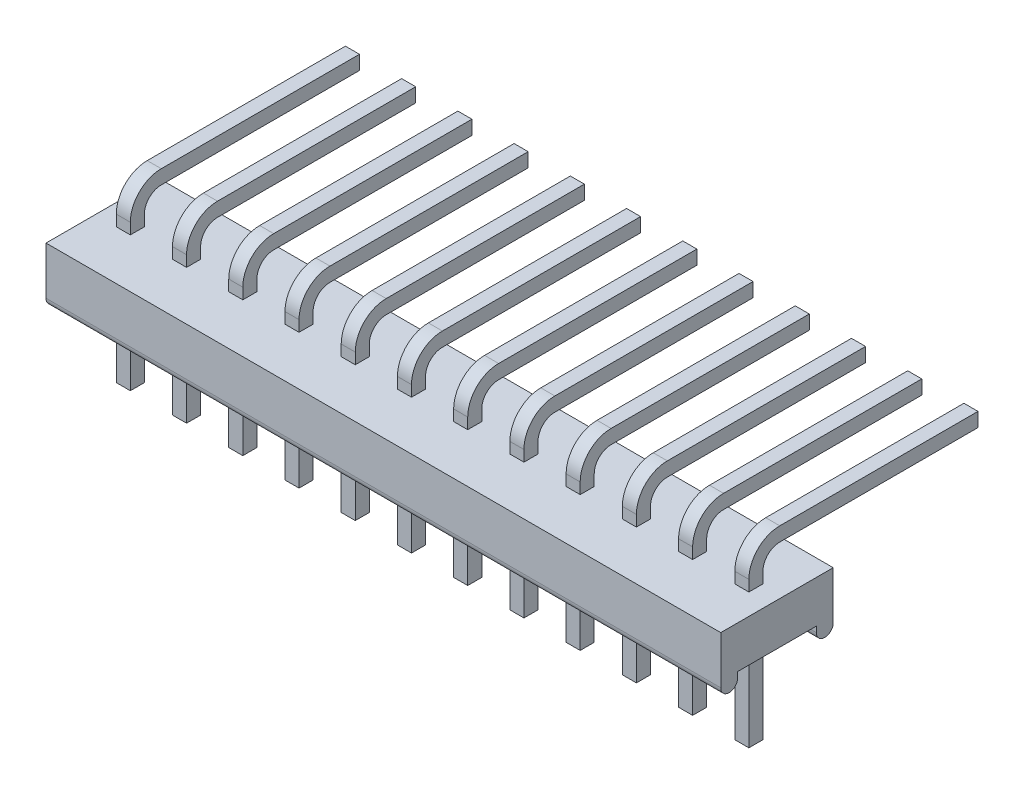
from build123d import *

# Parameters (mm, degrees)
SALIENTE_EXTRUIR1_DEPTH  = 30.48
CROQUIS2_W               = 0.635
CROQUIS2_H               = 0.635
SALIENTE_EXTRUIR2_DEPTH  = 1.8923
CROQUIS3_W               = 0.635
CROQUIS3_H               = 0.635
SALIENTE_EXTRUIR3_DEPTH  = 9.7155
CROQUIS4_W               = 0.635
CROQUIS4_H               = 0.635
SALIENTE_EXTRUIR4_DEPTH  = 1.8923
CROQUIS5_W               = 0.635
CROQUIS5_H               = 0.635
SALIENTE_EXTRUIR5_DEPTH  = 9.7155
CROQUIS6_W               = 0.635
CROQUIS6_H               = 0.635
SALIENTE_EXTRUIR6_DEPTH  = 1.8923
CROQUIS7_W               = 0.635
CROQUIS7_H               = 0.635
SALIENTE_EXTRUIR7_DEPTH  = 9.7155
CROQUIS8_W               = 0.635
CROQUIS8_H               = 0.635
SALIENTE_EXTRUIR8_DEPTH  = 1.8923
CROQUIS9_W               = 0.635
CROQUIS9_H               = 0.635
SALIENTE_EXTRUIR9_DEPTH  = 9.7155
CROQUIS10_W              = 0.635
CROQUIS10_H              = 0.635
SALIENTE_EXTRUIR10_DEPTH = 1.8923
CROQUIS11_W              = 0.635
CROQUIS11_H              = 0.635
SALIENTE_EXTRUIR11_DEPTH = 9.7155
CROQUIS12_W              = 0.635
CROQUIS12_H              = 0.635
SALIENTE_EXTRUIR12_DEPTH = 1.8923
CROQUIS13_W              = 0.635
CROQUIS13_H              = 0.635
SALIENTE_EXTRUIR13_DEPTH = 9.7155
CROQUIS14_W              = 0.635
CROQUIS14_H              = 0.635
SALIENTE_EXTRUIR14_DEPTH = 1.8923
CROQUIS15_W              = 0.635
CROQUIS15_H              = 0.635
SALIENTE_EXTRUIR15_DEPTH = 9.7155
CROQUIS16_W              = 0.635
CROQUIS16_H              = 0.635
SALIENTE_EXTRUIR16_DEPTH = 1.8923
CROQUIS17_W              = 0.635
CROQUIS17_H              = 0.635
SALIENTE_EXTRUIR17_DEPTH = 9.7155
CROQUIS18_W              = 0.635
CROQUIS18_H              = 0.635
SALIENTE_EXTRUIR18_DEPTH = 1.8923
CROQUIS19_W              = 0.635
CROQUIS19_H              = 0.635
SALIENTE_EXTRUIR19_DEPTH = 9.7155
CROQUIS20_W              = 0.635
CROQUIS20_H              = 0.635
SALIENTE_EXTRUIR20_DEPTH = 1.8923
CROQUIS21_W              = 0.635
CROQUIS21_H              = 0.635
SALIENTE_EXTRUIR21_DEPTH = 9.7155
CROQUIS22_W              = 0.635
CROQUIS22_H              = 0.635
SALIENTE_EXTRUIR22_DEPTH = 1.8923
CROQUIS23_W              = 0.635
CROQUIS23_H              = 0.635
SALIENTE_EXTRUIR23_DEPTH = 9.7155
CROQUIS24_W              = 0.635
CROQUIS24_H              = 0.635
SALIENTE_EXTRUIR24_DEPTH = 1.8923
CROQUIS25_W              = 0.635
CROQUIS25_H              = 0.635
SALIENTE_EXTRUIR25_DEPTH = 9.7155
CROQUIS26_W              = 0.635
CROQUIS26_H              = 0.635
SALIENTE_EXTRUIR26_DEPTH = 4.191
CROQUIS27_W              = 0.635
CROQUIS27_H              = 0.635
SALIENTE_EXTRUIR27_DEPTH = 4.191
CROQUIS28_W              = 0.635
CROQUIS28_H              = 0.635
SALIENTE_EXTRUIR28_DEPTH = 4.191
CROQUIS29_W              = 0.635
CROQUIS29_H              = 0.635
SALIENTE_EXTRUIR29_DEPTH = 4.191
CROQUIS30_W              = 0.635
CROQUIS30_H              = 0.635
SALIENTE_EXTRUIR30_DEPTH = 4.191
CROQUIS31_W              = 0.635
CROQUIS31_H              = 0.635
SALIENTE_EXTRUIR31_DEPTH = 4.191
CROQUIS32_W              = 0.635
CROQUIS32_H              = 0.635
SALIENTE_EXTRUIR32_DEPTH = 4.191
CROQUIS33_W              = 0.635
CROQUIS33_H              = 0.635
SALIENTE_EXTRUIR33_DEPTH = 4.191
CROQUIS34_W              = 0.635
CROQUIS34_H              = 0.635
SALIENTE_EXTRUIR34_DEPTH = 4.191
CROQUIS35_W              = 0.635
CROQUIS35_H              = 0.635
SALIENTE_EXTRUIR35_DEPTH = 4.191
CROQUIS36_W              = 0.635
CROQUIS36_H              = 0.635
SALIENTE_EXTRUIR36_DEPTH = 4.191
CROQUIS37_W              = 0.635
CROQUIS37_H              = 0.635
SALIENTE_EXTRUIR37_DEPTH = 4.191
REDONDEO1_R              = 0.762
REDONDEO2_R              = 1.397


with BuildPart() as part:
    # Croquis1 → Saliente-Extruir1 (new body)
    with BuildSketch(Plane(origin=(15.24, 0, 0), x_dir=(0, 0, -1), z_dir=(1, 0, 0))):
        with BuildLine():
            Line((-2.54, 1.905), (-2.54, -0.254))
            ThreePointArc((-2.54, -0.254), (-2.159, -0.635), (-1.778, -0.254))
            Line((-1.778, -0.254), (-1.778, 0))
            Line((-1.778, 0), (1.778, 0))
            Line((1.778, 0), (1.778, -0.254))
            ThreePointArc((1.778, -0.254), (2.159, -0.635), (2.54, -0.254))
            Line((2.54, -0.254), (2.54, 1.905))
            Line((2.54, 1.905), (-2.54, 1.905))
        make_face()
    extrude(amount=-SALIENTE_EXTRUIR1_DEPTH)

    # Croquis2 → Saliente-Extruir2 (add)
    with BuildSketch(Plane(origin=(0, 1.905, 0), x_dir=(-1, 0, 0), z_dir=(0, 1, 0))):
        with Locations((-13.97, 0)):
            Rectangle(CROQUIS2_W, CROQUIS2_H)
    extrude(amount=SALIENTE_EXTRUIR2_DEPTH)

    # Croquis3 → Saliente-Extruir3 (add)
    with BuildSketch(Plane(origin=(0, 0, -0.3175), x_dir=(-1, 0, 0), z_dir=(0, 0, -1))):
        with Locations((-13.97, 3.4798)):
            Rectangle(CROQUIS3_W, CROQUIS3_H)
    extrude(amount=SALIENTE_EXTRUIR3_DEPTH)

    # Croquis4 → Saliente-Extruir4 (add)
    with BuildSketch(Plane(origin=(0, 1.905, 0), x_dir=(-1, 0, 0), z_dir=(0, 1, 0))):
        with Locations((-11.43, 0)):
            Rectangle(CROQUIS4_W, CROQUIS4_H)
    extrude(amount=SALIENTE_EXTRUIR4_DEPTH)

    # Croquis5 → Saliente-Extruir5 (add)
    with BuildSketch(Plane(origin=(0, 0, -0.3175), x_dir=(-1, 0, 0), z_dir=(0, 0, -1))):
        with Locations((-11.43, 3.4798)):
            Rectangle(CROQUIS5_W, CROQUIS5_H)
    extrude(amount=SALIENTE_EXTRUIR5_DEPTH)

    # Croquis6 → Saliente-Extruir6 (add)
    with BuildSketch(Plane(origin=(0, 1.905, 0), x_dir=(-1, 0, 0), z_dir=(0, 1, 0))):
        with Locations((-8.89, 0)):
            Rectangle(CROQUIS6_W, CROQUIS6_H)
    extrude(amount=SALIENTE_EXTRUIR6_DEPTH)

    # Croquis7 → Saliente-Extruir7 (add)
    with BuildSketch(Plane(origin=(0, 0, -0.3175), x_dir=(-1, 0, 0), z_dir=(0, 0, -1))):
        with Locations((-8.89, 3.4798)):
            Rectangle(CROQUIS7_W, CROQUIS7_H)
    extrude(amount=SALIENTE_EXTRUIR7_DEPTH)

    # Croquis8 → Saliente-Extruir8 (add)
    with BuildSketch(Plane(origin=(0, 1.905, 0), x_dir=(-1, 0, 0), z_dir=(0, 1, 0))):
        with Locations((-6.35, 0)):
            Rectangle(CROQUIS8_W, CROQUIS8_H)
    extrude(amount=SALIENTE_EXTRUIR8_DEPTH)

    # Croquis9 → Saliente-Extruir9 (add)
    with BuildSketch(Plane(origin=(0, 0, -0.3175), x_dir=(-1, 0, 0), z_dir=(0, 0, -1))):
        with Locations((-6.35, 3.4798)):
            Rectangle(CROQUIS9_W, CROQUIS9_H)
    extrude(amount=SALIENTE_EXTRUIR9_DEPTH)

    # Croquis10 → Saliente-Extruir10 (add)
    with BuildSketch(Plane(origin=(0, 1.905, 0), x_dir=(-1, 0, 0), z_dir=(0, 1, 0))):
        with Locations((-3.81, 0)):
            Rectangle(CROQUIS10_W, CROQUIS10_H)
    extrude(amount=SALIENTE_EXTRUIR10_DEPTH)

    # Croquis11 → Saliente-Extruir11 (add)
    with BuildSketch(Plane(origin=(0, 0, -0.3175), x_dir=(-1, 0, 0), z_dir=(0, 0, -1))):
        with Locations((-3.81, 3.4798)):
            Rectangle(CROQUIS11_W, CROQUIS11_H)
    extrude(amount=SALIENTE_EXTRUIR11_DEPTH)

    # Croquis12 → Saliente-Extruir12 (add)
    with BuildSketch(Plane(origin=(0, 1.905, 0), x_dir=(-1, 0, 0), z_dir=(0, 1, 0))):
        with Locations((-1.27, 0)):
            Rectangle(CROQUIS12_W, CROQUIS12_H)
    extrude(amount=SALIENTE_EXTRUIR12_DEPTH)

    # Croquis13 → Saliente-Extruir13 (add)
    with BuildSketch(Plane(origin=(0, 0, -0.3175), x_dir=(-1, 0, 0), z_dir=(0, 0, -1))):
        with Locations((-1.27, 3.4798)):
            Rectangle(CROQUIS13_W, CROQUIS13_H)
    extrude(amount=SALIENTE_EXTRUIR13_DEPTH)

    # Croquis14 → Saliente-Extruir14 (add)
    with BuildSketch(Plane(origin=(0, 1.905, 0), x_dir=(-1, 0, 0), z_dir=(0, 1, 0))):
        with Locations((1.27, 0)):
            Rectangle(CROQUIS14_W, CROQUIS14_H)
    extrude(amount=SALIENTE_EXTRUIR14_DEPTH)

    # Croquis15 → Saliente-Extruir15 (add)
    with BuildSketch(Plane(origin=(0, 0, -0.3175), x_dir=(-1, 0, 0), z_dir=(0, 0, -1))):
        with Locations((1.27, 3.4798)):
            Rectangle(CROQUIS15_W, CROQUIS15_H)
    extrude(amount=SALIENTE_EXTRUIR15_DEPTH)

    # Croquis16 → Saliente-Extruir16 (add)
    with BuildSketch(Plane(origin=(0, 1.905, 0), x_dir=(-1, 0, 0), z_dir=(0, 1, 0))):
        with Locations((3.81, 0)):
            Rectangle(CROQUIS16_W, CROQUIS16_H)
    extrude(amount=SALIENTE_EXTRUIR16_DEPTH)

    # Croquis17 → Saliente-Extruir17 (add)
    with BuildSketch(Plane(origin=(0, 0, -0.3175), x_dir=(-1, 0, 0), z_dir=(0, 0, -1))):
        with Locations((3.81, 3.4798)):
            Rectangle(CROQUIS17_W, CROQUIS17_H)
    extrude(amount=SALIENTE_EXTRUIR17_DEPTH)

    # Croquis18 → Saliente-Extruir18 (add)
    with BuildSketch(Plane(origin=(0, 1.905, 0), x_dir=(-1, 0, 0), z_dir=(0, 1, 0))):
        with Locations((6.35, 0)):
            Rectangle(CROQUIS18_W, CROQUIS18_H)
    extrude(amount=SALIENTE_EXTRUIR18_DEPTH)

    # Croquis19 → Saliente-Extruir19 (add)
    with BuildSketch(Plane(origin=(0, 0, -0.3175), x_dir=(-1, 0, 0), z_dir=(0, 0, -1))):
        with Locations((6.35, 3.4798)):
            Rectangle(CROQUIS19_W, CROQUIS19_H)
    extrude(amount=SALIENTE_EXTRUIR19_DEPTH)

    # Croquis20 → Saliente-Extruir20 (add)
    with BuildSketch(Plane(origin=(0, 1.905, 0), x_dir=(-1, 0, 0), z_dir=(0, 1, 0))):
        with Locations((8.89, 0)):
            Rectangle(CROQUIS20_W, CROQUIS20_H)
    extrude(amount=SALIENTE_EXTRUIR20_DEPTH)

    # Croquis21 → Saliente-Extruir21 (add)
    with BuildSketch(Plane(origin=(0, 0, -0.3175), x_dir=(-1, 0, 0), z_dir=(0, 0, -1))):
        with Locations((8.89, 3.4798)):
            Rectangle(CROQUIS21_W, CROQUIS21_H)
    extrude(amount=SALIENTE_EXTRUIR21_DEPTH)

    # Croquis22 → Saliente-Extruir22 (add)
    with BuildSketch(Plane(origin=(0, 1.905, 0), x_dir=(-1, 0, 0), z_dir=(0, 1, 0))):
        with Locations((11.43, 0)):
            Rectangle(CROQUIS22_W, CROQUIS22_H)
    extrude(amount=SALIENTE_EXTRUIR22_DEPTH)

    # Croquis23 → Saliente-Extruir23 (add)
    with BuildSketch(Plane(origin=(0, 0, -0.3175), x_dir=(-1, 0, 0), z_dir=(0, 0, -1))):
        with Locations((11.43, 3.4798)):
            Rectangle(CROQUIS23_W, CROQUIS23_H)
    extrude(amount=SALIENTE_EXTRUIR23_DEPTH)

    # Croquis24 → Saliente-Extruir24 (add)
    with BuildSketch(Plane(origin=(0, 1.905, 0), x_dir=(-1, 0, 0), z_dir=(0, 1, 0))):
        with Locations((13.97, 0)):
            Rectangle(CROQUIS24_W, CROQUIS24_H)
    extrude(amount=SALIENTE_EXTRUIR24_DEPTH)

    # Croquis25 → Saliente-Extruir25 (add)
    with BuildSketch(Plane(origin=(0, 0, -0.3175), x_dir=(-1, 0, 0), z_dir=(0, 0, -1))):
        with Locations((13.97, 3.4798)):
            Rectangle(CROQUIS25_W, CROQUIS25_H)
    extrude(amount=SALIENTE_EXTRUIR25_DEPTH)

    # Croquis26 → Saliente-Extruir26 (add)
    with BuildSketch(Plane.XZ):
        with Locations((13.97, 0)):
            Rectangle(CROQUIS26_W, CROQUIS26_H)
    extrude(amount=SALIENTE_EXTRUIR26_DEPTH)

    # Croquis27 → Saliente-Extruir27 (add)
    with BuildSketch(Plane.XZ):
        with Locations((11.43, 0)):
            Rectangle(CROQUIS27_W, CROQUIS27_H)
    extrude(amount=SALIENTE_EXTRUIR27_DEPTH)

    # Croquis28 → Saliente-Extruir28 (add)
    with BuildSketch(Plane.XZ):
        with Locations((8.89, 0)):
            Rectangle(CROQUIS28_W, CROQUIS28_H)
    extrude(amount=SALIENTE_EXTRUIR28_DEPTH)

    # Croquis29 → Saliente-Extruir29 (add)
    with BuildSketch(Plane.XZ):
        with Locations((6.35, 0)):
            Rectangle(CROQUIS29_W, CROQUIS29_H)
    extrude(amount=SALIENTE_EXTRUIR29_DEPTH)

    # Croquis30 → Saliente-Extruir30 (add)
    with BuildSketch(Plane.XZ):
        with Locations((3.81, 0)):
            Rectangle(CROQUIS30_W, CROQUIS30_H)
    extrude(amount=SALIENTE_EXTRUIR30_DEPTH)

    # Croquis31 → Saliente-Extruir31 (add)
    with BuildSketch(Plane.XZ):
        with Locations((1.27, 0)):
            Rectangle(CROQUIS31_W, CROQUIS31_H)
    extrude(amount=SALIENTE_EXTRUIR31_DEPTH)

    # Croquis32 → Saliente-Extruir32 (add)
    with BuildSketch(Plane.XZ):
        with Locations((-1.27, 0)):
            Rectangle(CROQUIS32_W, CROQUIS32_H)
    extrude(amount=SALIENTE_EXTRUIR32_DEPTH)

    # Croquis33 → Saliente-Extruir33 (add)
    with BuildSketch(Plane.XZ):
        with Locations((-3.81, 0)):
            Rectangle(CROQUIS33_W, CROQUIS33_H)
    extrude(amount=SALIENTE_EXTRUIR33_DEPTH)

    # Croquis34 → Saliente-Extruir34 (add)
    with BuildSketch(Plane.XZ):
        with Locations((-6.35, 0)):
            Rectangle(CROQUIS34_W, CROQUIS34_H)
    extrude(amount=SALIENTE_EXTRUIR34_DEPTH)

    # Croquis35 → Saliente-Extruir35 (add)
    with BuildSketch(Plane.XZ):
        with Locations((-8.89, 0)):
            Rectangle(CROQUIS35_W, CROQUIS35_H)
    extrude(amount=SALIENTE_EXTRUIR35_DEPTH)

    # Croquis36 → Saliente-Extruir36 (add)
    with BuildSketch(Plane.XZ):
        with Locations((-11.43, 0)):
            Rectangle(CROQUIS36_W, CROQUIS36_H)
    extrude(amount=SALIENTE_EXTRUIR36_DEPTH)

    # Croquis37 → Saliente-Extruir37 (add)
    with BuildSketch(Plane.XZ):
        with Locations((-13.97, 0)):
            Rectangle(CROQUIS37_W, CROQUIS37_H)
    extrude(amount=SALIENTE_EXTRUIR37_DEPTH)

    # Redondeo1
    redondeo1_edges = [part.edges().sort_by_distance(p)[0] for p in [
        (6.35, 3.1623, -0.3175),
        (3.81, 3.1623, -0.3175),
        (1.27, 3.1623, -0.3175),
        (-1.27, 3.1623, -0.3175),
        (-3.81, 3.1623, -0.3175),
        (-6.35, 3.1623, -0.3175),
        (-8.89, 3.1623, -0.3175),
        (-11.43, 3.1623, -0.3175),
        (-13.97, 3.1623, -0.3175),
        (13.97, 3.1623, -0.3175),
        (11.43, 3.1623, -0.3175),
        (8.89, 3.1623, -0.3175),
    ]]
    fillet(redondeo1_edges, radius=REDONDEO1_R)

    # Redondeo2
    redondeo2_edges = [part.edges().sort_by_distance(p)[0] for p in [
        (6.35, 3.7973, 0.3175),
        (3.81, 3.7973, 0.3175),
        (1.27, 3.7973, 0.3175),
        (-1.27, 3.7973, 0.3175),
        (-3.81, 3.7973, 0.3175),
        (-6.35, 3.7973, 0.3175),
        (-8.89, 3.7973, 0.3175),
        (13.97, 3.7973, 0.3175),
        (-11.43, 3.7973, 0.3175),
        (-13.97, 3.7973, 0.3175),
        (11.43, 3.7973, 0.3175),
        (8.89, 3.7973, 0.3175),
    ]]
    fillet(redondeo2_edges, radius=REDONDEO2_R)


solid = part.part
